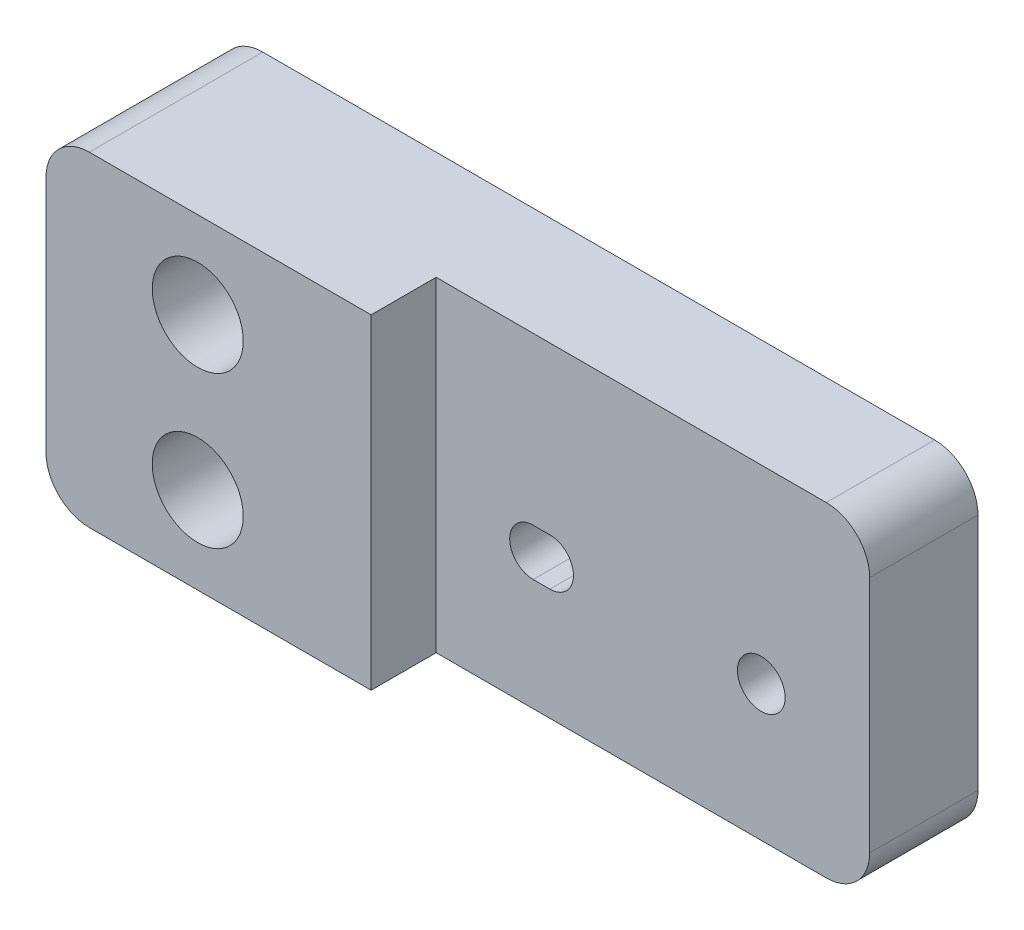
from build123d import *

# Parameters (mm, degrees)
ESQUISSE2_R             = 2.1
BOSS_EXTRU_1_DEPTH      = 5
ESQUISSE4_R             = 2.1
BOSS_EXTRU_2_DEPTH      = 3
ESQUISSE6_R             = 1.1
ENL_V_MAT_EXTRU_1_DEPTH = 10


with BuildPart() as part:
    # Esquisse2 → Boss.-Extru.1 (new body)
    with BuildSketch(Plane.XY):
        with BuildLine():
            Line((18, 0.75), (-13, 0.75))
            ThreePointArc((-13, 0.75), (-14.414213562, 0.164213562), (-15, -1.25))
            Line((-15, -1.25), (-15, -12.25))
            ThreePointArc((-15, -12.25), (-14.414213562, -13.664213562), (-13, -14.25))
            Line((-13, -14.25), (18, -14.25))
            ThreePointArc((18, -14.25), (19.414213562, -13.664213562), (20, -12.25))
            Line((20, -12.25), (20, -1.25))
            ThreePointArc((20, -1.25), (19.414213562, 0.164213562), (18, 0.75))
        make_face()
        with Locations((-8, -10.25)):
            Circle(ESQUISSE2_R, mode=Mode.SUBTRACT)
        with Locations((-8, -3.25)):
            Circle(ESQUISSE2_R, mode=Mode.SUBTRACT)
    extrude(amount=BOSS_EXTRU_1_DEPTH)

    # Esquisse4 → Boss.-Extru.2 (add)
    with BuildSketch(Plane.XY.offset(5)):
        with BuildLine():
            Line((0, 0.75), (0, -14.25))
            Line((0, -14.25), (-13, -14.25))
            ThreePointArc((-13, -14.25), (-14.414213562, -13.664213562), (-15, -12.25))
            Line((-15, -12.25), (-15, -1.25))
            ThreePointArc((-15, -1.25), (-14.414213562, 0.164213562), (-13, 0.75))
            Line((-13, 0.75), (0, 0.75))
        make_face()
        with Locations((-8, -10.25)):
            Circle(ESQUISSE4_R, mode=Mode.SUBTRACT)
        with Locations((-8, -3.25)):
            Circle(ESQUISSE4_R, mode=Mode.SUBTRACT)
    extrude(amount=BOSS_EXTRU_2_DEPTH)

    # Esquisse6 → Enlèv. mat.-Extru.1 (cut)
    with BuildSketch(Plane(origin=(0, 0, 0), x_dir=(-1, 0, 0), z_dir=(0, 0, -1))):
        with Locations((-15, -7.997523441)):
            Circle(ESQUISSE6_R)
        with BuildLine():
            Line((-5.249999883, -6.914758131), (-4.478449657, -6.914758131))
            ThreePointArc((-4.478449657, -6.914758131), (-3.393207978, -7.99999981), (-4.478449657, -9.085241489))
            Line((-4.478449657, -9.085241489), (-5.249999883, -9.085241489))
            ThreePointArc((-5.249999883, -9.085241489), (-6.335241562, -7.99999981), (-5.249999883, -6.914758131))
        make_face()
    extrude(amount=-ENL_V_MAT_EXTRU_1_DEPTH, mode=Mode.SUBTRACT)


solid = part.part
